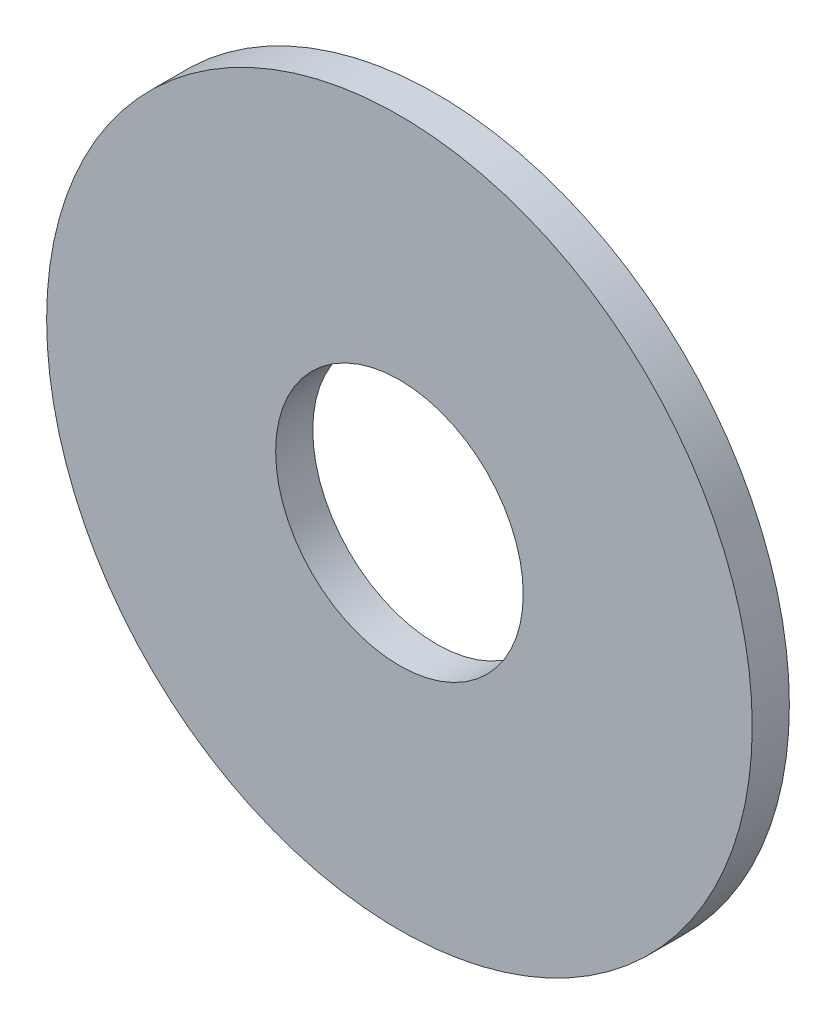
from build123d import *

# Parameters (mm, degrees)
SKETCH1_R      = 7.239
SKETCH1_R_2    = 2.54
EXTRUDE1_DEPTH = 0.762


with BuildPart() as part:
    # Sketch1 → Extrude1 (new body)
    with BuildSketch(Plane.XY):
        Circle(SKETCH1_R)
        Circle(SKETCH1_R_2, mode=Mode.SUBTRACT)
    extrude(amount=-EXTRUDE1_DEPTH)


solid = part.part
